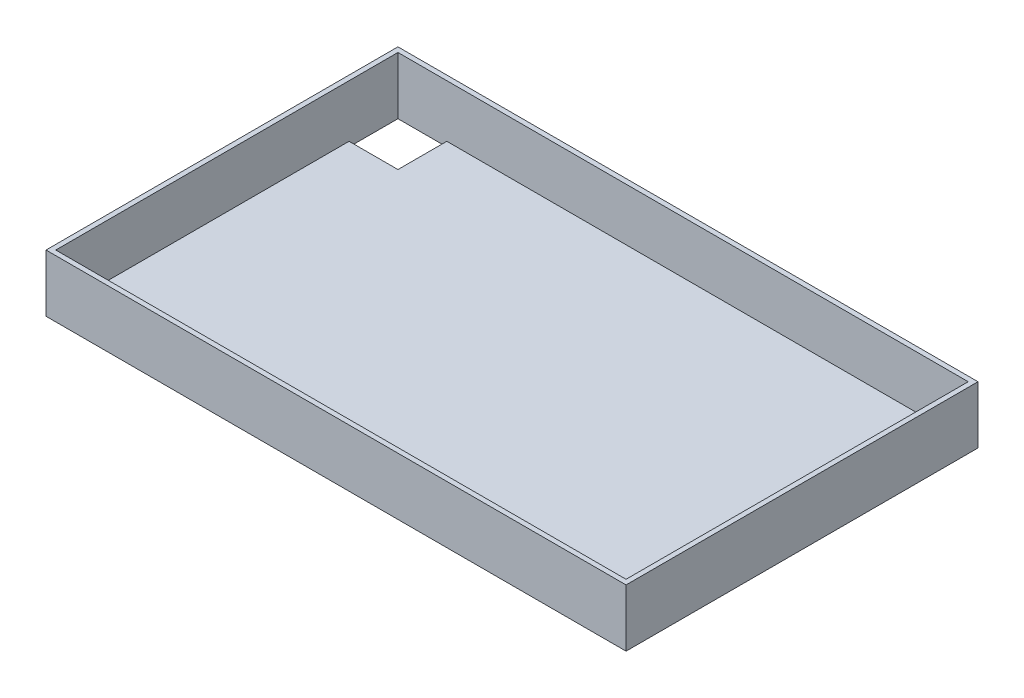
from build123d import *

# Parameters (mm, degrees)
SKETCH1_W               = 350
SKETCH1_H               = 210
BOSS_EXTRUDE1_DEPTH     = 32.22
SHELL1_T                = 3
SKETCH2_W               = 30
SKETCH2_H               = 30
CUT_EXTRUDE2_DEPTH      = 211.680156636
MIRROR2_COPY_1_SKETCH_W = 30
MIRROR2_COPY_1_SKETCH_H = 30
MIRROR2_COPY_1_DEPTH    = 211.680156636


with BuildPart() as part:
    # Sketch1 → Boss-Extrude1 (new body)
    with BuildSketch(Plane(origin=(0, 0, 0), x_dir=(1, 0, 0), z_dir=(0, 1, 0))):
        Rectangle(SKETCH1_W, SKETCH1_H)
    extrude(amount=BOSS_EXTRUDE1_DEPTH)

    # Shell1
    shell1_openings = [part.faces().sort_by_distance(p)[0] for p in [
        (0, 32.22, 0),
    ]]
    offset(amount=SHELL1_T, openings=shell1_openings, kind=Kind.INTERSECTION)

    # Sketch2 → Cut-Extrude2 (cut, through all)
    with BuildSketch(Plane(origin=(0, 0, 0), x_dir=(1, 0, 0), z_dir=(0, 1, 0))):
        with Locations((160, 90)):
            Rectangle(SKETCH2_W, SKETCH2_H)
    cut_extrude2 = extrude(amount=-CUT_EXTRUDE2_DEPTH, mode=Mode.SUBTRACT)

    # Mirror1: Cut-Extrude2 across plane
    add(cut_extrude2.mirror(Plane.XY), mode=Mode.SUBTRACT)

    # Mirror2: Cut-Extrude2 across plane
    add(cut_extrude2.mirror(Plane(origin=(0, 0, 0), x_dir=(0, 0, 1), z_dir=(1, 0, 0))), mode=Mode.SUBTRACT)

    # Mirror2 copy 1 sketch → Mirror2 copy 1 (cut, through all)
    with BuildSketch(Plane(origin=(0, 0, 0), x_dir=(-1, 0, 0), z_dir=(0, 1, 0))):
        with Locations((160, 90)):
            Rectangle(MIRROR2_COPY_1_SKETCH_W, MIRROR2_COPY_1_SKETCH_H)
    extrude(amount=-MIRROR2_COPY_1_DEPTH, mode=Mode.SUBTRACT)


solid = part.part
